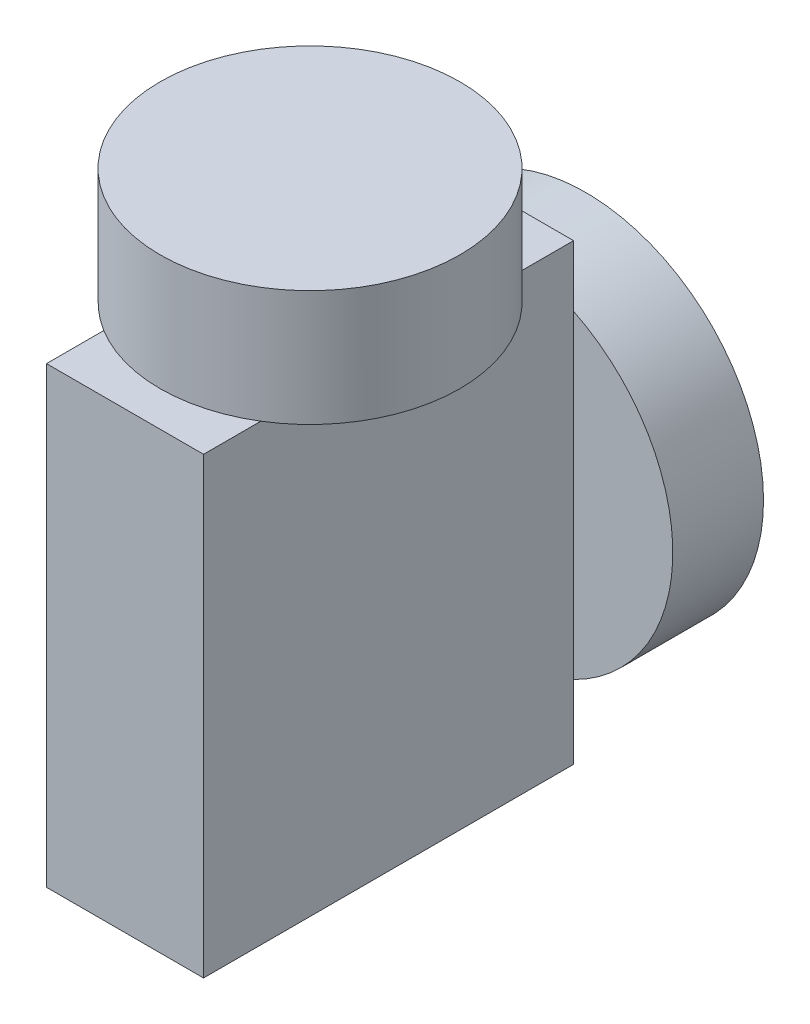
from build123d import *

# Parameters (mm, degrees)
SKETCH_1_R      = 29.748261452
EXTRUDE_1_DEPTH = 23
SKETCH_5_W      = 31.165698276
SKETCH_5_H      = 73.42599541
EXTRUDE_4_DEPTH = 90
SKETCH_6_R      = 35.273996594
EXTRUDE_5_DEPTH = 18


with BuildPart() as part:
    # 草图1 → 凸台-拉伸1 (new body)
    with BuildSketch(Plane(origin=(0, 0, 0), x_dir=(1, 0, 0), z_dir=(0, 1, 0))):
        with Locations(Location((0, 0, 0), (0, 0, 270))):
            Circle(SKETCH_1_R)
    extrude(amount=EXTRUDE_1_DEPTH)

    # 草图5 → 凸台-拉伸4 (add)
    with BuildSketch(Plane.XZ):
        Rectangle(SKETCH_5_W, SKETCH_5_H)
    extrude(amount=EXTRUDE_4_DEPTH)

    # 草图6 → 凸台-拉伸5 (add)
    with BuildSketch(Plane(origin=(0, 0, -36.712997705), x_dir=(-1, 0, 0), z_dir=(0, 0, -1))):
        with Locations(Location((0, -43.77696479, 0), (0, 0, 116.216607407))):
            Circle(SKETCH_6_R)
    extrude(amount=EXTRUDE_5_DEPTH)


solid = part.part
